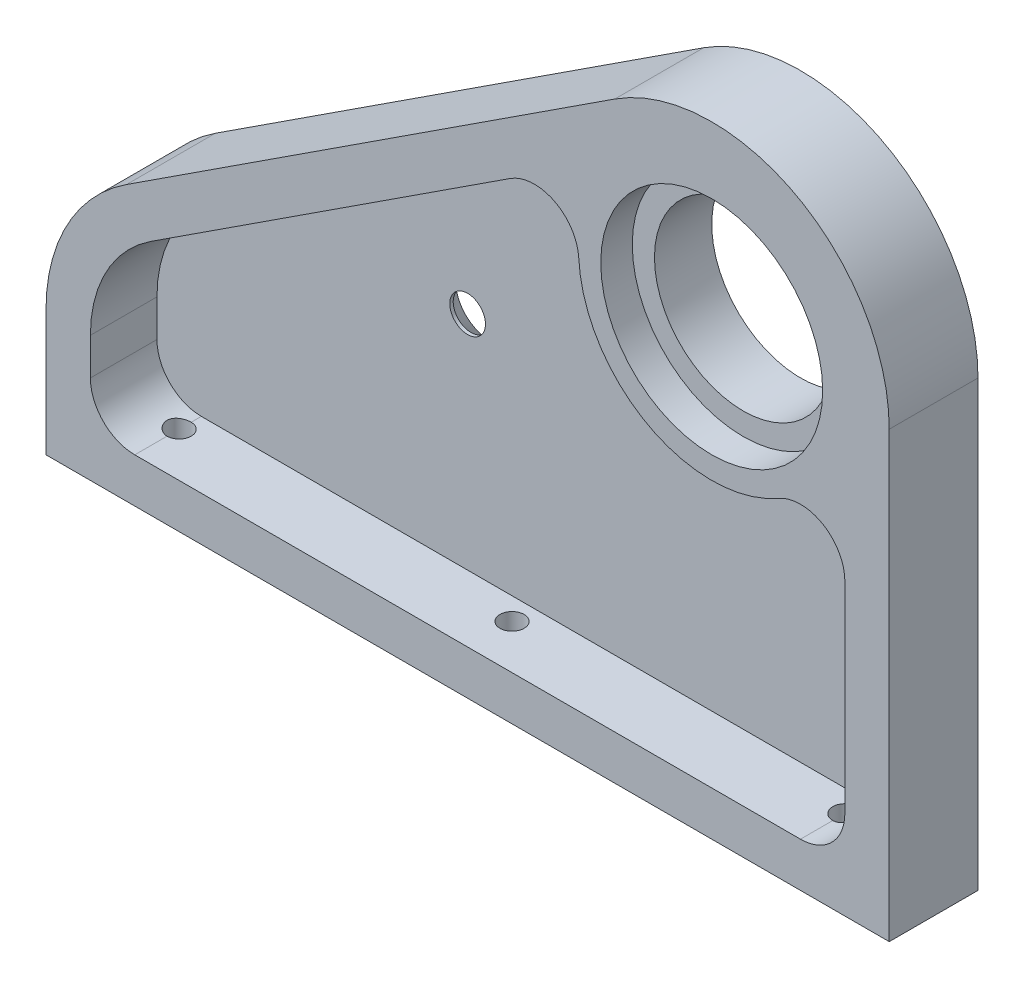
from build123d import *

# Parameters (mm, degrees)
BOSS_EXTRUDE1_DEPTH                             = 6.35
SKETCH4_R                                       = 12.7
CUT_EXTRUDE3_DEPTH                              = 116.178567885
SKETCH5_R                                       = 15.875
CUT_EXTRUDE4_DEPTH                              = 4.5085
FILLET1_R                                       = 25.4
CUT_EXTRUDE5_DEPTH                              = 9.525
FILLET2_R                                       = 6.35
F_8_32_TAPPED_HOLE1_D                           = 3.4544
F_8_32_TAPPED_HOLE1_DEPTH                       = 10.668
F_8_32_TAPPED_HOLE1_TIP                         = 1.037806461
CSK_FOR_10_FLAT_HEAD_MACHINE_SCREW1_D           = 5.1054
CSK_FOR_10_FLAT_HEAD_MACHINE_SCREW1_CSINK_D     = 9.779
CSK_FOR_10_FLAT_HEAD_MACHINE_SCREW1_CSINK_ANGLE = 82


with BuildPart() as part:
    # Sketch1 → Boss-Extrude1 (new, symmetric)
    with BuildSketch(Plane.XY):
        with BuildLine():
            Line((25.4, 0), (25.4, -63.5))
            Line((25.4, -63.5), (-95.25, -63.5))
            Line((-95.25, -63.5), (-95.25, -31.75))
            Line((-95.25, -31.75), (-13.866905739, 21.280717216))
            ThreePointArc((-13.866905739, 21.280717216), (12.10249136, 22.33136142), (25.4, 0))
        make_face()
    extrude(amount=BOSS_EXTRUDE1_DEPTH, both=True)

    # Sketch4 → Cut-Extrude3 (cut, through all)
    with BuildSketch(Plane.XY.offset(6.35)):
        Circle(SKETCH4_R)
    extrude(amount=-CUT_EXTRUDE3_DEPTH, mode=Mode.SUBTRACT)

    # Sketch5 → Cut-Extrude4 (cut)
    with BuildSketch(Plane(origin=(0, 0, 6.35), x_dir=(-1, 0, 0), z_dir=(0, 0, -1))):
        Circle(SKETCH5_R)
    extrude(amount=CUT_EXTRUDE4_DEPTH, mode=Mode.SUBTRACT)

    # Fillet1
    fillet1_edges = [part.edges().sort_by_distance(p)[0] for p in [
        (-95.25, -31.75, 0),
    ]]
    fillet(fillet1_edges, radius=FILLET1_R)

    # Sketch9 → Cut-Extrude5 (cut)
    with BuildSketch(Plane.XY.offset(6.35)):
        with BuildLine():
            Line((-10.400179304, 15.960537912), (-80.250179304, -29.555003506))
            ThreePointArc((-80.250179304, -29.555003506), (-86.598521065, -36.438672898), (-88.9, -45.515541418))
            Line((-88.9, -45.515541418), (-88.9, -57.15))
            Line((-88.9, -57.15), (19.05, -57.15))
            Line((19.05, -57.15), (19.05, 0))
            ThreePointArc((19.05, 0), (-9.07686852, -16.748521065), (-10.400179304, 15.960537912))
        make_face()
    extrude(amount=-CUT_EXTRUDE5_DEPTH, mode=Mode.SUBTRACT)

    # Fillet2
    fillet2_edges = [part.edges().sort_by_distance(p)[0] for p in [
        (-10.400179304, 15.960537912, 1.5875),
        (19.05, 0, 1.5875),
        (19.05, -57.15, 1.5875),
        (-88.9, -57.15, 1.5875),
    ]]
    fillet(fillet2_edges, radius=FILLET2_R)

    # #8-32 Tapped Hole1
    with Locations(Plane.XZ.offset(63.5)):
        with Locations((-82.55, 0), (-34.925, 0), (12.7, 0)):
            Hole(F_8_32_TAPPED_HOLE1_D / 2, depth=F_8_32_TAPPED_HOLE1_DEPTH)
            with Locations((0, 0, -(F_8_32_TAPPED_HOLE1_DEPTH + F_8_32_TAPPED_HOLE1_TIP / 2))):  # 118° drill point
                Cone(0, F_8_32_TAPPED_HOLE1_D / 2, F_8_32_TAPPED_HOLE1_TIP, mode=Mode.SUBTRACT)

    # CSK for #10 Flat Head Machine Screw1 (through all)
    with Locations(Plane(origin=(0, 0, -6.35), x_dir=(-1, 0, 0), z_dir=(0, 0, -1))):
        with Locations((44.45, -25.4)):
            CounterSinkHole(CSK_FOR_10_FLAT_HEAD_MACHINE_SCREW1_D / 2, CSK_FOR_10_FLAT_HEAD_MACHINE_SCREW1_CSINK_D / 2, counter_sink_angle=CSK_FOR_10_FLAT_HEAD_MACHINE_SCREW1_CSINK_ANGLE)


solid = part.part
